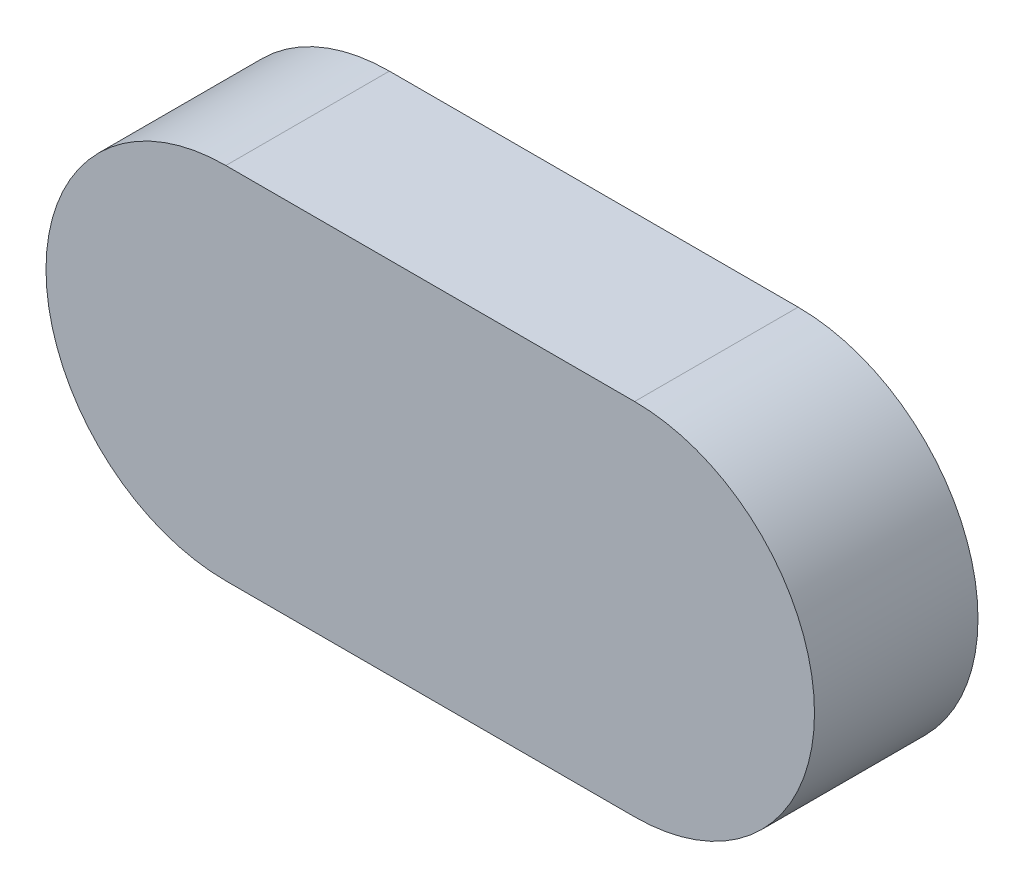
from build123d import *

# Parameters (mm, degrees)
CRANKLINK_DEPTH = 10


with BuildPart() as part:
    # 草图3 → CrankLink (new body)
    with BuildSketch(Plane.XY):
        with BuildLine():
            Line((20, 61), (45, 61))
            ThreePointArc((45, 61), (56, 50), (45, 39))
            Line((45, 39), (20, 39))
            ThreePointArc((20, 39), (9, 50), (20, 61))
        make_face()
    extrude(amount=CRANKLINK_DEPTH)


solid = part.part
